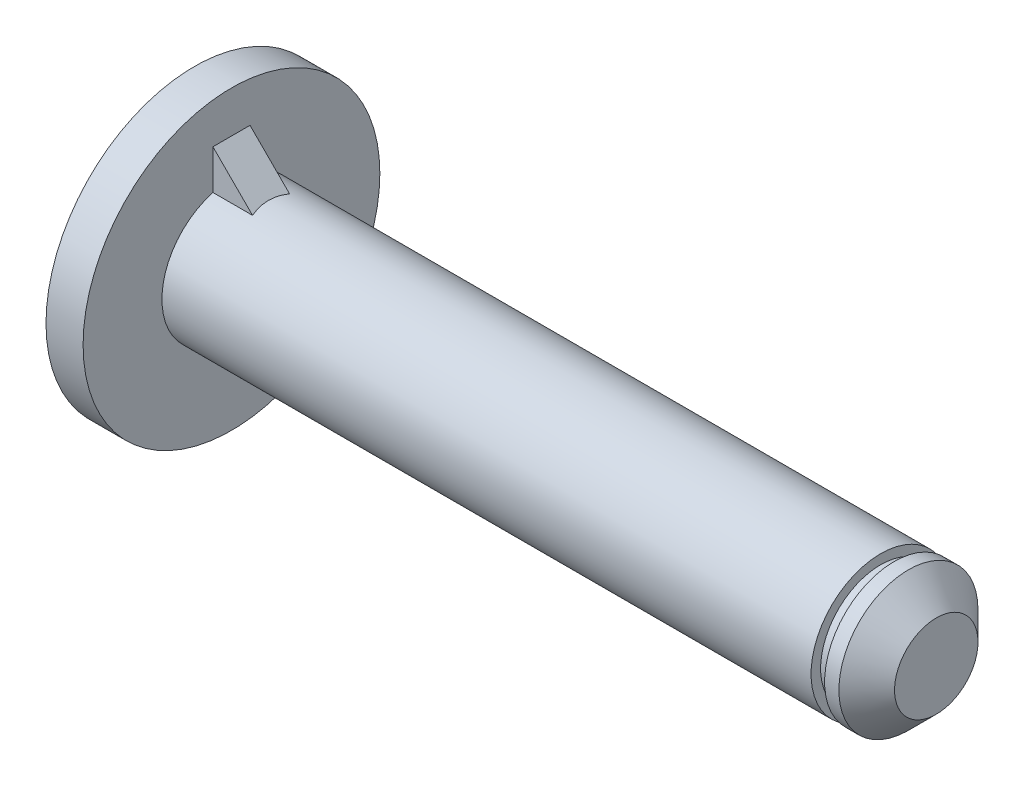
from build123d import *

# Parameters (mm, degrees)
RIB11_REACH    = 45.818
SKETCH7_WALL_W = 92.464036326
SKETCH7_WALL_H = 2
CHAMFER1_SIZE  = 1.5
SKETCH8_W      = 0.73
SKETCH8_H      = 0.515


with BuildPart() as part:
    # Sketch1 → Revolve1 (revolve)
    with BuildSketch(Plane.XY, mode=Mode.PRIVATE) as revolve1_sk:
        Polygon((0, 0), (2, 0), (2, 4.25), (37, 4.25), (40, 4.25), (40, 8), (0, 8), align=None)
    revolve(revolve1_sk.sketch.rotate(Axis((-10.111111111, 8, 0), (1, 0, 0)), 270), axis=Axis((-10.111111111, 8, 0), (1, 0, 0)))

    # Sketch7 wall → Rib11 (add, up to next)
    with BuildSketch(Plane(origin=(3, 12.75, 0), x_dir=(0.707106781187, -0.707106781187, 0), z_dir=(0.707106781187, 0.707106781187, 0)), mode=Mode.PRIVATE) as rib11_sk1:
        Rectangle(SKETCH7_WALL_W, SKETCH7_WALL_H)
    rib11_tool1 = extrude(rib11_sk1.sketch, amount=-RIB11_REACH, mode=Mode.PRIVATE) - part.part
    add(rib11_tool1.solids().sort_by_distance((3, 12.75, 0))[0])

    # Chamfer1
    chamfer1_edges = [part.edges().sort_by_distance(p)[0] for p in [
        (40, 8, -3.75),
    ]]
    chamfer(chamfer1_edges, length=CHAMFER1_SIZE)

    # Sketch8 → Cut-Revolve1 (revolve, cut)
    with BuildSketch(Plane.XY, mode=Mode.PRIVATE) as cut_revolve1_sk:
        with Locations((37.365, 11.4925)):
            Rectangle(SKETCH8_W, SKETCH8_H)
    revolve(cut_revolve1_sk.sketch.rotate(Axis((40, 8, 0), (-1, 0, 0)), 90), axis=Axis((40, 8, 0), (-1, 0, 0)), mode=Mode.SUBTRACT)


solid = part.part
